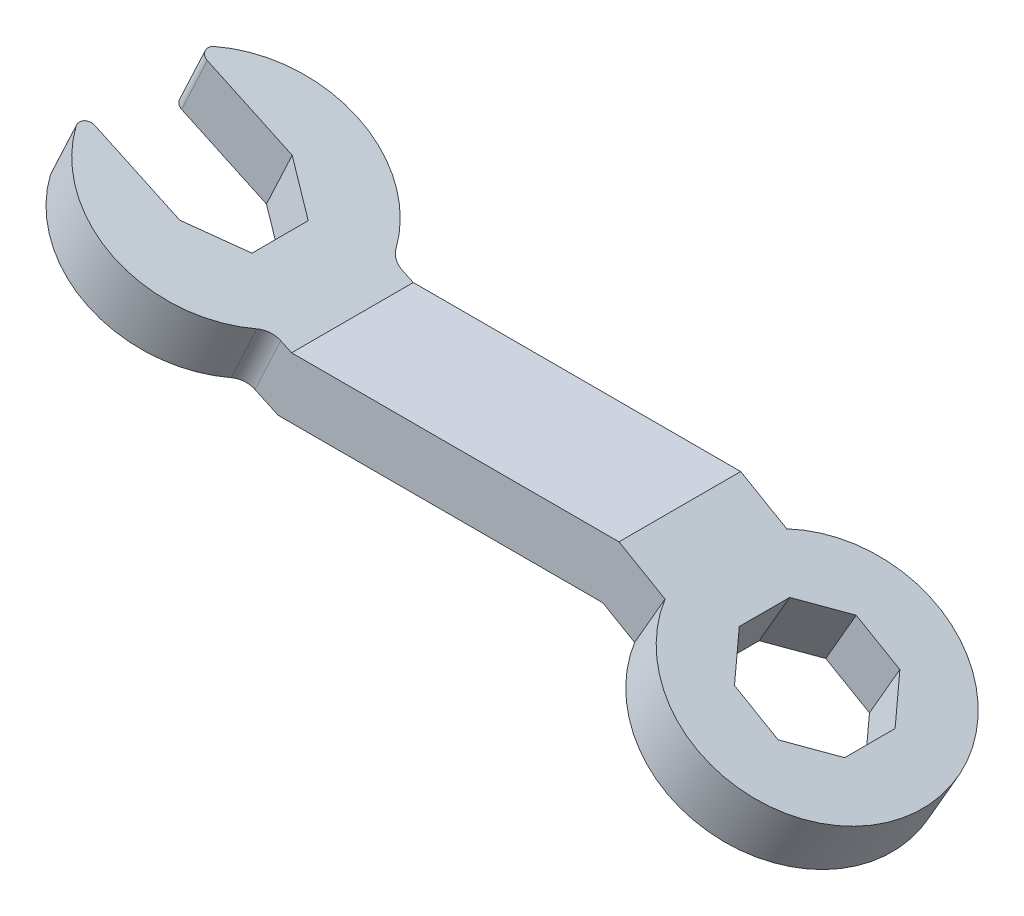
from build123d import *

# Parameters (mm, degrees)
EXTRUDE_1_DEPTH          = 15
CUT_EXTRUDE_1_DEPTH      = 109.392019307
CUT_EXTRUDE_1_DEPTH_BACK = 109.392019307
SKETCH_3_R               = 30
SKETCH_3_3_R             = 30
EXTRUDE_2_DEPTH          = 15
EXTRUDE_3_DEPTH          = 15
CUT_EXTRUDE_2_DEPTH      = 153.192153917
CUT_EXTRUDE_2_DEPTH_BACK = 153.192153917
FILLET_1_R               = 5
FILLET_2_R               = 2


with BuildPart() as part:
    # 草图1 → 凸台-拉伸1 (new, symmetric)
    with BuildSketch(Plane.XY):
        Polygon((0, 0), (80, 0), (106.830127019, -15.490381057), (114.330127019, -2.5), (84.019237886, 15), (3.32541994, 15), (-25.38149862, 28.386255966), (-31.720772546, 14.791639161), align=None)
    extrude(amount=EXTRUDE_1_DEPTH, both=True)

    # 草图3 → 切除-拉伸1 (cut, two sides: drawn at the far end of the back side and taken through both)
    with BuildSketch(Plane(origin=(27.5, 47.631397208, 0), x_dir=(0.866025403784438, -0.5000000000000012, 0), z_dir=(0.5000000000000012, 0.866025403784438, 0)).offset(-CUT_EXTRUDE_1_DEPTH_BACK)):
        with Locations((104.345320277, 0)):
            Circle(SKETCH_3_R)
        Polygon((119.345320277, -6.213203436), (119.345320277, 6.213203436), (110.558523712, 15), (98.132116841, 15), (89.345320277, 6.213203436), (89.345320277, -6.213203436), (98.132116841, -15), (110.558523712, -15), align=None, mode=Mode.SUBTRACT)
    extrude(amount=CUT_EXTRUDE_1_DEPTH + CUT_EXTRUDE_1_DEPTH_BACK, mode=Mode.SUBTRACT)


with BuildPart() as body_2:
    # of the pieces the cut leaves, the one that is kept (cut_extrude_1_keep)
    add(part.part.solids().sort_by_distance((0, 0, -15))[0])

    # 草图3<3> → 凸台-拉伸2 (add)
    with BuildSketch(Plane(origin=(27.5, 47.631397208, 0), x_dir=(0.866025403784438, -0.5000000000000012, 0), z_dir=(0.5000000000000012, 0.866025403784438, 0))):
        with Locations((104.345320277, 0)):
            Circle(SKETCH_3_3_R)
        Polygon((119.345320277, -6.213203436), (119.345320277, 6.213203436), (110.558523712, 15), (98.132116841, 15), (89.345320277, 6.213203436), (89.345320277, -6.213203436), (98.132116841, -15), (110.558523712, -15), align=None, mode=Mode.SUBTRACT)
    extrude(amount=-EXTRUDE_2_DEPTH)

    # 草图6 → 凸台-拉伸3 (add)
    with BuildSketch(Plane(origin=(0, 0, 0), x_dir=(0.9063077870366528, -0.4226182617406936, 0), z_dir=(-0.4226182617406936, -0.9063077870366528, 0))):
        with BuildLine():
            Line((-61.608269391, 13.856406461), (-35, 13.856406461))
            Line((-35, 13.856406461), (-35, 15))
            Line((-35, 15), (-9.019237886, 15))
            ThreePointArc((-9.019237886, 15), (-35.652221505, 29.99290928), (-61.608269391, 13.856406461))
        make_face()
        with BuildLine():
            Line((-35, 15), (-35, 13.856406461))
            Line((-35, 13.856406461), (-23, 6.92820323))
            Line((-23, 6.92820323), (-23, -6.92820323))
            Line((-23, -6.92820323), (-35, -13.856406461))
            Line((-35, -13.856406461), (-35, -15))
            Line((-35, -15), (-9.019237886, -15))
            ThreePointArc((-9.019237886, -15), (-5, 0), (-9.019237886, 15))
            Line((-9.019237886, 15), (-35, 15))
        make_face()
        with BuildLine():
            Line((-35, -15), (-35, -13.856406461))
            Line((-35, -13.856406461), (-61.608269391, -13.856406461))
            ThreePointArc((-61.608269391, -13.856406461), (-35.652221505, -29.99290928), (-9.019237886, -15))
            Line((-9.019237886, -15), (-35, -15))
        make_face()
    extrude(amount=-EXTRUDE_3_DEPTH)

    # 草图6<4> → 切除-拉伸2 (cut, two sides: drawn at the far end of the back side and taken through both)
    with BuildSketch(Plane(origin=(0, 0, 0), x_dir=(0.9063077870366528, -0.4226182617406936, 0), z_dir=(-0.4226182617406936, -0.9063077870366528, 0)).offset(-CUT_EXTRUDE_2_DEPTH_BACK)):
        Polygon((-23, 6.92820323), (-35, 13.856406461), (-35, -13.856406461), (-23, -6.92820323), align=None)
    extrude(amount=CUT_EXTRUDE_2_DEPTH + CUT_EXTRUDE_2_DEPTH_BACK, mode=Mode.SUBTRACT)

    # 圆角1
    fillet_1_edges = [body_2.edges().sort_by_distance(p)[0] for p in [
        (-5.004568567, 10.609003041, -15),
        (-5.004568567, 10.609003041, 15),
    ]]
    fillet(fillet_1_edges, radius=FILLET_1_R)

    # 圆角2
    fillet_2_edges = [body_2.edges().sort_by_distance(p)[0] for p in [
        (-52.666417332, 32.834088122, -13.856406461),
        (-52.666417332, 32.834088122, 13.856406461),
    ]]
    fillet(fillet_2_edges, radius=FILLET_2_R)


solid = body_2.part
